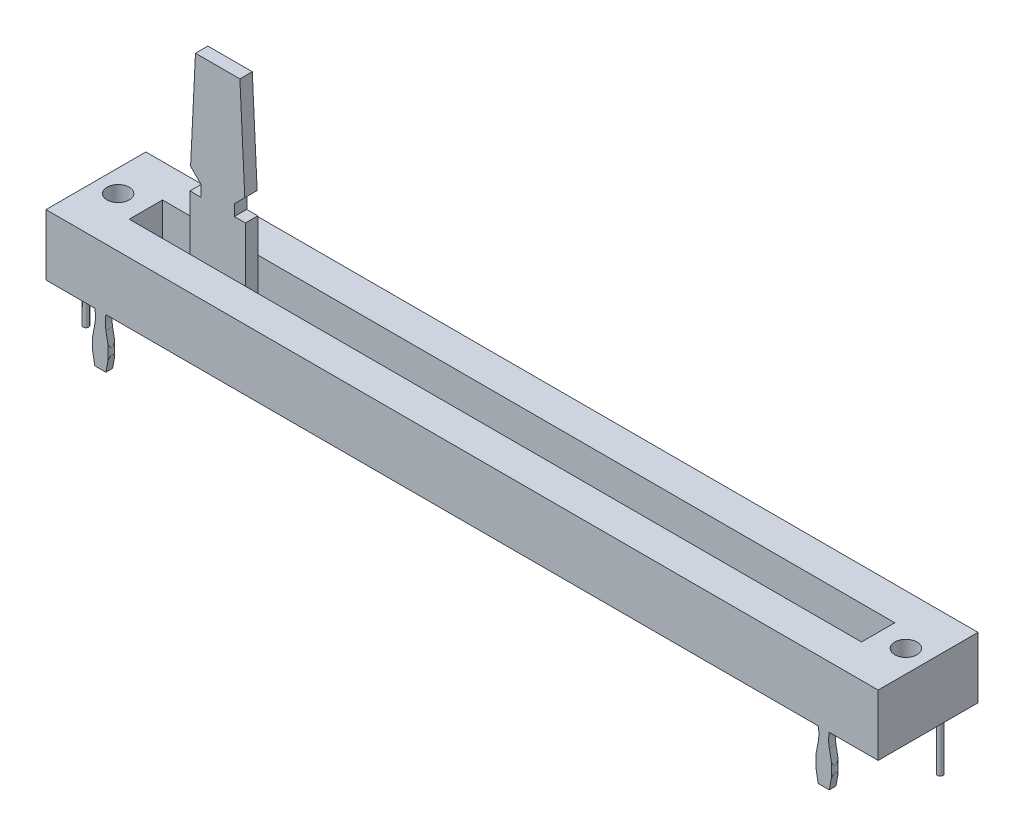
from build123d import *

# Parameters (mm, degrees)
SKETCH1_W           = 75
SKETCH1_H           = 9
SKETCH1_R           = 1
SKETCH1_W_2         = 66
SKETCH1_H_2         = 3
BOSS_EXTRUDE1_DEPTH = 5.5
SKETCH2_W           = 5
SKETCH2_H           = 1.11692796
BOSS_EXTRUDE2_DEPTH = 20.5
CUT_EXTRUDE1_DEPTH  = 1.116928
SKETCH5_R           = 0.25
BOSS_EXTRUDE3_DEPTH = 4.5
CUT_EXTRUDE2_DEPTH  = 0.6
CUT_EXTRUDE3_DEPTH  = 8.411242
SKETCH8_W           = 75
SKETCH8_H           = 9
BOSS_EXTRUDE4_DEPTH = 1


with BuildPart() as part:
    # Sketch1 → Boss-Extrude1 (new body)
    with BuildSketch(Plane(origin=(0, 0, 0), x_dir=(1, 0, 0), z_dir=(0, 1, 0))):
        Rectangle(SKETCH1_W, SKETCH1_H)
        with Locations(Location((-35.5, 0, 0), (0, 0, 270))):
            Circle(SKETCH1_R, mode=Mode.SUBTRACT)
        with Locations(Location((35.5, 0, 0), (0, 0, 270))):
            Circle(SKETCH1_R, mode=Mode.SUBTRACT)
        Rectangle(SKETCH1_W_2, SKETCH1_H_2, mode=Mode.SUBTRACT)
    extrude(amount=BOSS_EXTRUDE1_DEPTH)

    # Sketch5 → Boss-Extrude3 (add)
    with BuildSketch(Plane.XZ):
        with Locations(Location((-36.65, 1.75, 0), (0, 0, 270))):
            Circle(SKETCH5_R)
        with Locations(Location((-36.65, -1.75, 0), (0, 0, 270))):
            Circle(SKETCH5_R)
        with Locations(Location((36.85, -1.75, 0), (0, 0, 270))):
            Circle(SKETCH5_R)
        with BuildLine():
            Line((-33.287386354, 3.9), (-31.912613646, 3.9))
            ThreePointArc((-31.912613646, 3.9), (-31.85, 4.2), (-31.912613646, 4.5))
            Line((-31.912613646, 4.5), (-33.287386354, 4.5))
            ThreePointArc((-33.287386354, 4.5), (-33.35, 4.2), (-33.287386354, 3.9))
        make_face()
        with BuildLine():
            Line((-32.082369536, -4.511242375), (-30.717630464, -4.511242375))
            ThreePointArc((-30.717630464, -4.511242375), (-30.65, -4.2), (-30.717630464, -3.888757625))
            Line((-30.717630464, -3.888757625), (-32.082369536, -3.888757625))
            ThreePointArc((-32.082369536, -3.888757625), (-32.15, -4.2), (-32.082369536, -4.511242375))
        make_face()
        with BuildLine():
            Line((31.912613646, 3.9), (33.287386354, 3.9))
            ThreePointArc((33.287386354, 3.9), (33.35, 4.2), (33.287386354, 4.5))
            Line((33.287386354, 4.5), (31.912613646, 4.5))
            ThreePointArc((31.912613646, 4.5), (31.85, 4.2), (31.912613646, 3.9))
        make_face()
        with BuildLine():
            Line((30.717630464, -4.511242375), (32.082369536, -4.511242375))
            ThreePointArc((32.082369536, -4.511242375), (32.15, -4.2), (32.082369536, -3.888757625))
            Line((32.082369536, -3.888757625), (30.717630464, -3.888757625))
            ThreePointArc((30.717630464, -3.888757625), (30.65, -4.2), (30.717630464, -4.511242375))
        make_face()
    extrude(amount=BOSS_EXTRUDE3_DEPTH)

    # Sketch6 → Cut-Extrude2 (cut)
    with BuildSketch(Plane.XY.offset(4.5)):
        with BuildLine():
            Line((-33.09934336, -4.5), (-33.402270595, -2.851761941))
            Line((-33.402270595, -2.851761941), (-33.09934336, -1.235884142))
            ThreePointArc((-33.09934336, -1.235884142), (-33.041920989, -0.617942071), (-33.09934336, 0))
            Line((-33.09934336, 0), (-33.402270595, 0))
            Line((-33.402270595, 0), (-33.650950836, -2.851761941))
            Line((-33.650950836, -2.851761941), (-33.402270595, -4.555674549))
            Line((-33.402270595, -4.555674549), (-33.09934336, -4.5))
        make_face()
        with BuildLine():
            Line((-31.797729405, -4.555674549), (-32.10065664, -4.5))
            Line((-32.10065664, -4.5), (-31.797729405, -2.851761941))
            Line((-31.797729405, -2.851761941), (-32.10065664, -1.235884142))
            ThreePointArc((-32.10065664, -1.235884142), (-32.158079011, -0.617942071), (-32.10065664, 0))
            Line((-32.10065664, 0), (-31.797729405, 0))
            Line((-31.797729405, 0), (-31.549049164, -2.851761941))
            Line((-31.549049164, -2.851761941), (-31.797729405, -4.555674549))
        make_face()
        with BuildLine():
            Line((32.098701368, -4.503617362), (31.795774133, -2.855379303))
            Line((31.795774133, -2.855379303), (32.098701368, -1.239501504))
            ThreePointArc((32.098701368, -1.239501504), (32.156123739, -0.621559433), (32.098701368, -0.003617362))
            Line((32.098701368, -0.003617362), (31.795774133, -0.003617362))
            Line((31.795774133, -0.003617362), (31.547093892, -2.855379303))
            Line((31.547093892, -2.855379303), (31.795774133, -4.55929191))
            Line((31.795774133, -4.55929191), (32.098701368, -4.503617362))
        make_face()
        with BuildLine():
            Line((33.400315323, -4.55929191), (33.097388088, -4.503617362))
            Line((33.097388088, -4.503617362), (33.400315323, -2.855379303))
            Line((33.400315323, -2.855379303), (33.097388088, -1.239501504))
            ThreePointArc((33.097388088, -1.239501504), (33.039965717, -0.621559433), (33.097388088, -0.003617362))
            Line((33.097388088, -0.003617362), (33.400315323, -0.003617362))
            Line((33.400315323, -0.003617362), (33.648995564, -2.855379303))
            Line((33.648995564, -2.855379303), (33.400315323, -4.55929191))
        make_face()
    extrude(amount=-CUT_EXTRUDE2_DEPTH, mode=Mode.SUBTRACT)

    # Sketch7 → Cut-Extrude3 (cut)
    with BuildSketch(Plane(origin=(0, 0, -4.511242375), x_dir=(-1, 0, 0), z_dir=(0, 0, -1))):
        with BuildLine():
            Line((-31.907807642, -4.506121234), (-32.210734877, -2.857883176))
            Line((-32.210734877, -2.857883176), (-31.907807642, -1.242005377))
            ThreePointArc((-31.907807642, -1.242005377), (-31.850385271, -0.624063306), (-31.907807642, -0.006121234))
            Line((-31.907807642, -0.006121234), (-32.210734877, -0.006121234))
            Line((-32.210734877, -0.006121234), (-32.459415119, -2.857883176))
            Line((-32.459415119, -2.857883176), (-32.210734877, -4.561795783))
            Line((-32.210734877, -4.561795783), (-31.907807642, -4.506121234))
        make_face()
        with BuildLine():
            Line((-30.606193688, -4.561795783), (-30.909120923, -4.506121234))
            Line((-30.909120923, -4.506121234), (-30.606193688, -2.857883176))
            Line((-30.606193688, -2.857883176), (-30.909120923, -1.242005377))
            ThreePointArc((-30.909120923, -1.242005377), (-30.966543293, -0.624063306), (-30.909120923, -0.006121234))
            Line((-30.909120923, -0.006121234), (-30.606193688, -0.006121234))
            Line((-30.606193688, -0.006121234), (-30.357513446, -2.857883176))
            Line((-30.357513446, -2.857883176), (-30.606193688, -4.561795783))
        make_face()
        with BuildLine():
            Line((30.900953031, -4.503761329), (30.598025796, -2.855523271))
            Line((30.598025796, -2.855523271), (30.900953031, -1.239645472))
            ThreePointArc((30.900953031, -1.239645472), (30.958375402, -0.6217034), (30.900953031, -0.003761329))
            Line((30.900953031, -0.003761329), (30.598025796, -0.003761329))
            Line((30.598025796, -0.003761329), (30.349345554, -2.855523271))
            Line((30.349345554, -2.855523271), (30.598025796, -4.559435878))
            Line((30.598025796, -4.559435878), (30.900953031, -4.503761329))
        make_face()
        with BuildLine():
            Line((32.202566985, -4.559435878), (31.89963975, -4.503761329))
            Line((31.89963975, -4.503761329), (32.202566985, -2.855523271))
            Line((32.202566985, -2.855523271), (31.89963975, -1.239645472))
            ThreePointArc((31.89963975, -1.239645472), (31.84221738, -0.6217034), (31.89963975, -0.003761329))
            Line((31.89963975, -0.003761329), (32.202566985, -0.003761329))
            Line((32.202566985, -0.003761329), (32.451247227, -2.855523271))
            Line((32.451247227, -2.855523271), (32.202566985, -4.559435878))
        make_face()
    extrude(amount=-CUT_EXTRUDE3_DEPTH, mode=Mode.SUBTRACT)



with BuildPart() as body_2:
    # Sketch2 → Boss-Extrude2 (new body)
    with BuildSketch(Plane(origin=(0, 0, 0), x_dir=(1, 0, 0), z_dir=(0, 1, 0))):
        with Locations((-25.96857506, 0)):
            Rectangle(SKETCH2_W, SKETCH2_H)
    extrude(amount=BOSS_EXTRUDE2_DEPTH)

    # Sketch4 → Cut-Extrude1 (cut)
    with BuildSketch(Plane.XY.offset(0.55846398)):
        Polygon((-25.96857506, 20.5), (-23.966726729, 20.5), (-23.52657778, 11.443467599), (-24.464038646, 10.506006733), (-24.464038646, 9.502793508), (-23.46857506, 9.502793508), (-23.167793716, 10.25), (-23.167793716, 20.769867565), (-28.695341592, 20.769867565), (-28.695341592, 10.25), (-28.46857506, 9.502793508), (-27.464847532, 9.502793508), (-27.464847532, 10.506006733), (-28.410251154, 11.451410355), (-27.970976519, 20.5), align=None)
    extrude(amount=-CUT_EXTRUDE1_DEPTH, mode=Mode.SUBTRACT)


with BuildPart() as part_1:
    add(part.part)

    add(body_2.part)  # Boss-Extrude4 merges body 2
    # Sketch8 → Boss-Extrude4 (add)
    with BuildSketch(Plane.XZ):
        Rectangle(SKETCH8_W, SKETCH8_H)
    extrude(amount=-BOSS_EXTRUDE4_DEPTH)


solid = part_1.part
